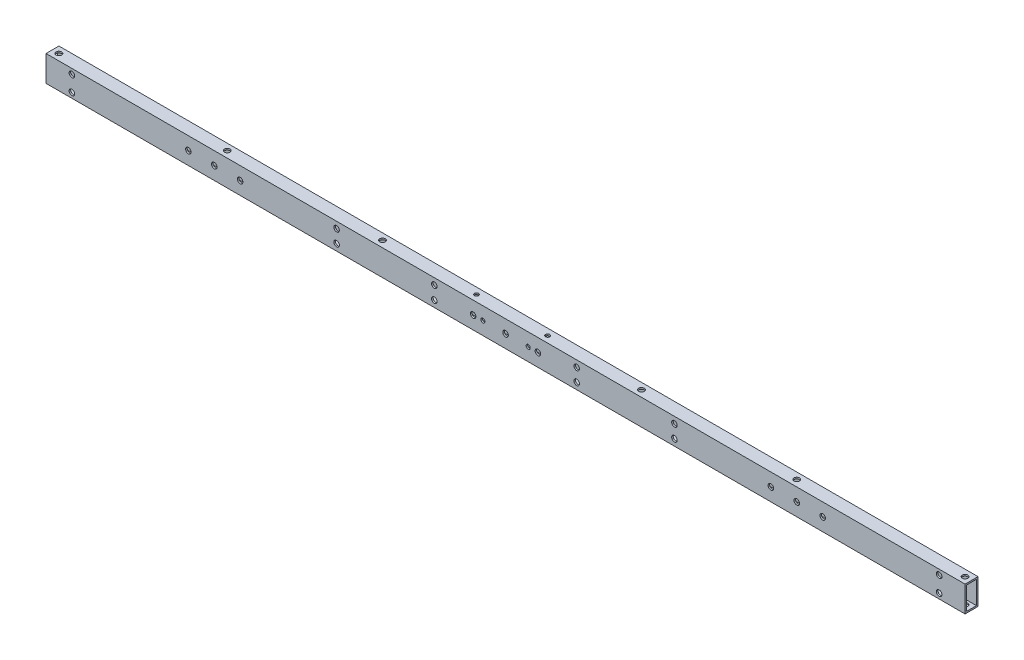
from build123d import *

# Parameters (mm, degrees)
SKETCH_1_W          = 10
SKETCH_1_H          = 20
SKETCH_1_W_2        = 7.6
SKETCH_1_H_2        = 17.6
EXTRUDE_1_DEPTH     = 710
SKETCH_2_R          = 2.15
SKETCH_2_R_2        = 1.6
CUT_EXTRUDE_1_DEPTH = 711.299232718
SKETCH_3_R          = 2.15
SKETCH_3_R_2        = 1.6
CUT_EXTRUDE_2_DEPTH = 711.140831103
SKETCH_5_R          = 2.15
CUT_EXTRUDE_3_DEPTH = 711.140831103


with BuildPart() as part:
    # ｽｹｯﾁ1 → 押し出し-薄板1 (new body)
    with BuildSketch(Plane(origin=(0, 0, 0), x_dir=(0, 0, -1), z_dir=(1, 0, 0))):
        Rectangle(SKETCH_1_W, SKETCH_1_H)
        Rectangle(SKETCH_1_W_2, SKETCH_1_H_2, mode=Mode.SUBTRACT)
    extrude(amount=EXTRUDE_1_DEPTH)

    # ｽｹｯﾁ2 → ｶｯﾄ - 押し出し1 (cut, through all)
    with BuildSketch(Plane(origin=(0, 10, 0), x_dir=(1, 0, 0), z_dir=(0, 1, 0))):
        with Locations(Location((575, 0, 0), (0, 0, 270))):
            Circle(SKETCH_2_R)
        with Locations(Location((705, 0, 0), (0, 0, 270))):
            Circle(SKETCH_2_R)
        with Locations(Location((5, 0, 0), (0, 0, 270))):
            Circle(SKETCH_2_R)
        with Locations(Location((135, 0, 0), (0, 0, 270))):
            Circle(SKETCH_2_R)
        with Locations(Location((455, 0, 0), (0, 0, 270))):
            Circle(SKETCH_2_R)
        with Locations(Location((255, 0, 0), (0, 0, 270))):
            Circle(SKETCH_2_R)
        with Locations(Location((382.5, 0, 0), (0, 0, 270))):
            Circle(SKETCH_2_R_2)
        with Locations(Location((327.5, 0, 0), (0, 0, 270))):
            Circle(SKETCH_2_R_2)
    extrude(amount=-CUT_EXTRUDE_1_DEPTH, mode=Mode.SUBTRACT)

    # ｽｹｯﾁ3 → ｶｯﾄ - 押し出し2 (cut, through all)
    with BuildSketch(Plane.XY.offset(5)):
        with Locations((410, 5)):
            Circle(SKETCH_3_R)
        with Locations(Location((410, -5, 0), (0, 0, 90))):
            Circle(SKETCH_3_R)
        with Locations((690, 6)):
            Circle(SKETCH_3_R)
        with Locations(Location((690, -6, 0), (0, 0, 90))):
            Circle(SKETCH_3_R)
        with Locations(Location((20, 6, 0), (0, 0, 90))):
            Circle(SKETCH_3_R)
        with Locations((20, -6)):
            Circle(SKETCH_3_R)
        with Locations((300, -5)):
            Circle(SKETCH_3_R)
        with Locations(Location((300, 5, 0), (0, 0, 90))):
            Circle(SKETCH_3_R)
        with Locations((372.5, 0)):
            Circle(SKETCH_3_R_2)
        with Locations(Location((337.5, 0, 0), (0, 0, 90))):
            Circle(SKETCH_3_R_2)
        with Locations(Location((224.5, 5, 0), (0, 0, 90))):
            Circle(SKETCH_3_R)
        with Locations((110, 0)):
            Circle(SKETCH_3_R)
        with Locations((130, 0)):
            Circle(SKETCH_3_R)
        with Locations((150, 0)):
            Circle(SKETCH_3_R)
        with Locations(Location((560, 0, 0), (0, 0, 90))):
            Circle(SKETCH_3_R)
        with Locations(Location((580, 0, 0), (0, 0, 90))):
            Circle(SKETCH_3_R)
        with Locations(Location((600, 0, 0), (0, 0, 90))):
            Circle(SKETCH_3_R)
        with Locations((224.5, -5)):
            Circle(SKETCH_3_R)
        with Locations(Location((485.5, -5, 0), (0, 0, 90))):
            Circle(SKETCH_3_R)
        with Locations((485.5, 5)):
            Circle(SKETCH_3_R)
    extrude(amount=-CUT_EXTRUDE_2_DEPTH, mode=Mode.SUBTRACT)

    # ｽｹｯﾁ5 → ｶｯﾄ - 押し出し3 (cut, through all)
    with BuildSketch(Plane.XY.offset(5)):
        with Locations((380, 0)):
            Circle(SKETCH_5_R)
        with Locations(Location((330, 0, 0), (0, 0, 90))):
            Circle(SKETCH_5_R)
        with Locations((355, 0)):
            Circle(SKETCH_5_R)
    extrude(amount=-CUT_EXTRUDE_3_DEPTH, mode=Mode.SUBTRACT)


solid = part.part
